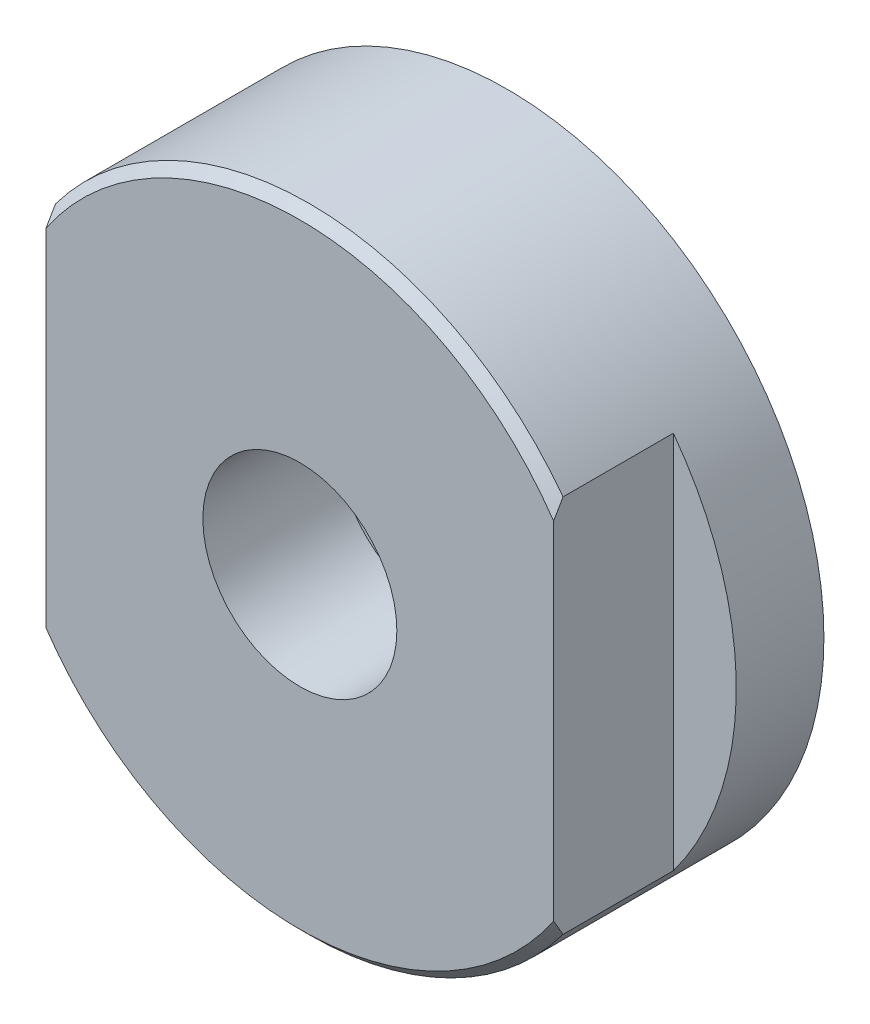
from build123d import *

# Parameters (mm, degrees)
SKETCH1_R        = 16.8
BODY_DEPTH       = 11
BODYCHAMFER_SIZE = 0.5
BODYFLAT_START   = -6.35
BODYFLAT_DEPTH   = 6.35


with BuildPart() as part:
    # Sketch1 → Body (new body)
    with BuildSketch(Plane.XY):
        Circle(SKETCH1_R)
    extrude(amount=BODY_DEPTH)

    # BodyChamfer
    bodychamfer_edges = [part.edges().sort_by_distance(p)[0] for p in [
        (-16.8, 0, 11),
    ]]
    chamfer(bodychamfer_edges, length=BODYCHAMFER_SIZE)

    # Sketch2 → BodyFlat (cut)
    with BuildSketch(Plane.XY.offset(11).offset(BODYFLAT_START)):
        with BuildLine():
            Line((-13.462, -10.050599783), (-13.462, 10.050599783))
            ThreePointArc((-13.462, 10.050599783), (-16.8, 0), (-13.462, -10.050599783))
        make_face()
        with BuildLine():
            Line((13.462, -10.050599783), (13.462, 10.050599783))
            ThreePointArc((13.462, 10.050599783), (16.8, 0), (13.462, -10.050599783))
        make_face()
    extrude(amount=BODYFLAT_DEPTH, mode=Mode.SUBTRACT)

    # Sketch4 → 1/8 NPT Tapped Hole1 (revolve, cut)
    with BuildSketch(Plane(origin=(0, 0, 11), x_dir=(0, -1, 0), z_dir=(1, 0, 0))):
        Polygon((0, 0), (0, 14.533468714), (4.2164, 12), (4.2164, 7), (4.936183926, 7), (5.1457733, 0), align=None)
    revolve(axis=Axis((0, 0, 17.35), (0, 0, -1)), mode=Mode.SUBTRACT)


solid = part.part
